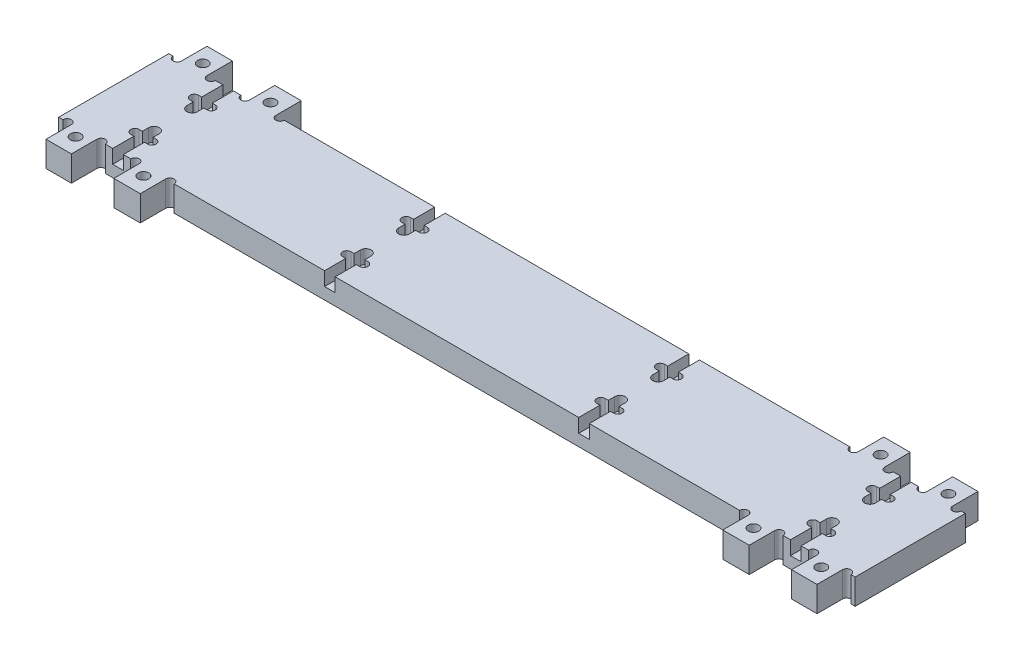
from build123d import *

# Parameters (mm, degrees)
SKETCH1_W                         = 376
SKETCH1_H                         = 52
BOSS_EXTRUDE1_DEPTH               = 12
SKETCH6_W                         = 12.5
SKETCH6_H                         = 12
SKETCH6_W_2                       = 12
BOSS_EXTRUDE2_DEPTH               = 12
F_5_0_5_DIAMETER_HOLE1_AT_2_COUNT = 2
F_5_0_5_DIAMETER_HOLE1_AT_2_PITCH = 32
MIRROR4_COPY_2_SKETCH_W           = 12.5
MIRROR4_COPY_2_SKETCH_H           = 12
MIRROR4_COPY_2_SKETCH_W_2         = 12
MIRROR4_COPY_2_DEPTH              = 12
CUT_EXTRUDE2_DEPTH                = 8
CUT_EXTRUDE5_DEPTH                = 6.5
CUT_EXTRUDE1_REACH                = 194.177
LPATTERN1_COUNT                   = 2
LPATTERN1_PITCH                   = 100
MIRROR1_COPY_1_DEPTH              = 8
MIRROR1_COPY_2_DEPTH              = 6.5
MIRROR2_COPY_1_DEPTH              = 8
MIRROR2_COPY_2_DEPTH              = 6.5
MIRROR2_COPY_3_DEPTH              = 8
MIRROR2_COPY_4_DEPTH              = 6.5
MIRROR2_COPY_5_REACH              = 194.177
MIRROR2_COPY_6_DEPTH              = 8
MIRROR2_COPY_7_DEPTH              = 6.5


with BuildPart() as part:
    # Sketch1 → Boss-Extrude1 (new body)
    with BuildSketch(Plane(origin=(0, 0, 0), x_dir=(1, 0, 0), z_dir=(0, 1, 0))):
        Rectangle(SKETCH1_W, SKETCH1_H)
    extrude(amount=BOSS_EXTRUDE1_DEPTH)

    # Sketch6 → Boss-Extrude2 (add)
    with BuildSketch(Plane(origin=(0, 12, 0), x_dir=(1, 0, 0), z_dir=(0, 1, 0))):
        with Locations((143.75, -32)):
            Rectangle(SKETCH6_W, SKETCH6_H)
        with Locations((176, -32)):
            Rectangle(SKETCH6_W_2, SKETCH6_H)
    boss_extrude2 = extrude(amount=-BOSS_EXTRUDE2_DEPTH)

    # Sketch12 → Ø5.0 (5) Diameter Hole1 (revolve, cut)
    with BuildSketch(Plane(origin=(176, 12, 30), x_dir=(0, 0, 1), z_dir=(1, 0, 0))):
        Polygon((0, 0), (0, 13.502151548), (2.5, 12), (2.5, 0), align=None)
    f_5_0_5_diameter_hole1 = revolve(axis=Axis((176, 18.35, 30), (0, -1, 0)), mode=Mode.SUBTRACT)

    # Ø5.0 (5) Diameter Hole1 at 2: Ø5.0 (5) Diameter Hole1 ×2
    with Locations(*[(-i * F_5_0_5_DIAMETER_HOLE1_AT_2_PITCH, 0, 0) for i in range(1, F_5_0_5_DIAMETER_HOLE1_AT_2_COUNT)]):
        add(f_5_0_5_diameter_hole1, mode=Mode.SUBTRACT)

    # Mirror3: Boss-Extrude2, Ø5.0 (5) Diameter Hole1 across plane
    add(boss_extrude2.mirror(Plane.XY))
    add(f_5_0_5_diameter_hole1.mirror(Plane.XY), mode=Mode.SUBTRACT)

    # Mirror3 copy 1 sketch → Mirror3 copy 1 (revolve, cut)
    with BuildSketch(Plane(origin=(144, 12, -30), x_dir=(0, 0, -1), z_dir=(1, 0, 0))):
        Polygon((0, 0), (0, -13.502151548), (2.5, -12), (2.5, 0), align=None)
    revolve(axis=Axis((144, 18.35, -30), (0, 1, 0)), mode=Mode.SUBTRACT)

    # Mirror4: Boss-Extrude2, Ø5.0 (5) Diameter Hole1 across plane
    add(boss_extrude2.mirror(Plane(origin=(0, 0, 0), x_dir=(0, 0, 1), z_dir=(1, 0, 0))))
    add(f_5_0_5_diameter_hole1.mirror(Plane(origin=(0, 0, 0), x_dir=(0, 0, 1), z_dir=(1, 0, 0))), mode=Mode.SUBTRACT)

    # Mirror4 copy 1 sketch → Mirror4 copy 1 (revolve, cut)
    with BuildSketch(Plane(origin=(-144, 12, 30), x_dir=(0, 0, 1), z_dir=(-1, 0, 0))):
        Polygon((0, 0), (0, -13.502151548), (2.5, -12), (2.5, 0), align=None)
    revolve(axis=Axis((-144, 18.35, 30), (0, 1, 0)), mode=Mode.SUBTRACT)

    # Mirror4 copy 2 sketch → Mirror4 copy 2 (add)
    with BuildSketch(Plane(origin=(0, 12, 0), x_dir=(-1, 0, 0), z_dir=(0, 1, 0))):
        with Locations((143.75, -32)):
            Rectangle(MIRROR4_COPY_2_SKETCH_W, MIRROR4_COPY_2_SKETCH_H)
        with Locations((176, -32)):
            Rectangle(MIRROR4_COPY_2_SKETCH_W_2, MIRROR4_COPY_2_SKETCH_H)
    extrude(amount=-MIRROR4_COPY_2_DEPTH)

    # Mirror4 copy 3 sketch → Mirror4 copy 3 (revolve, cut)
    with BuildSketch(Plane(origin=(-176, 12, -30), x_dir=(0, 0, -1), z_dir=(-1, 0, 0))):
        Polygon((0, 0), (0, 13.502151548), (2.5, 12), (2.5, 0), align=None)
    revolve(axis=Axis((-176, 18.35, -30), (0, -1, 0)), mode=Mode.SUBTRACT)

    # Mirror4 copy 4 sketch → Mirror4 copy 4 (revolve, cut)
    with BuildSketch(Plane(origin=(-144, 12, -30), x_dir=(0, 0, -1), z_dir=(-1, 0, 0))):
        Polygon((0, 0), (0, 13.502151548), (2.5, 12), (2.5, 0), align=None)
    revolve(axis=Axis((-144, 18.35, -30), (0, -1, 0)), mode=Mode.SUBTRACT)

    # Sketch8 → Cut-Extrude2 (cut)
    with BuildSketch(Plane(origin=(0, 12, 0), x_dir=(1, 0, 0), z_dir=(0, 1, 0))):
        with BuildLine():
            Line((-164, -12), (-156, -12))
            ThreePointArc((-156, -12), (-154, -14), (-156, -16))
            Line((-156, -16), (-164, -16))
            ThreePointArc((-164, -16), (-166, -14), (-164, -12))
        make_face()
    cut_extrude2 = extrude(amount=-CUT_EXTRUDE2_DEPTH, mode=Mode.SUBTRACT)

    # Sketch11 → Cut-Extrude5 (cut)
    with BuildSketch(Plane(origin=(0, 12, 0), x_dir=(1, 0, 0), z_dir=(0, 1, 0))):
        with BuildLine():
            Line((-157.5, -9), (-157.5, -34.810021273))
            ThreePointArc((-157.5, -34.810021273), (-160, -37.310021273), (-162.5, -34.810021273))
            Line((-162.5, -34.810021273), (-162.5, -9))
            ThreePointArc((-162.5, -9), (-160, -6.5), (-157.5, -9))
        make_face()
    cut_extrude5 = extrude(amount=-CUT_EXTRUDE5_DEPTH, mode=Mode.SUBTRACT)

    # Sketch7 → Cut-Extrude1 (cut, up to next)
    with BuildSketch(Plane(origin=(0, 12, 0), x_dir=(1, 0, 0), z_dir=(0, 1, 0)), mode=Mode.PRIVATE) as cut_extrude1_sk1:
        with BuildLine():
            Line((133.5, -26), (137.5, -26))
            ThreePointArc((137.5, -26), (135.5, -24), (133.5, -26))
        make_face()
    cut_extrude1_tool1 = extrude(cut_extrude1_sk1.sketch, amount=-CUT_EXTRUDE1_REACH, mode=Mode.PRIVATE) & part.part
    # Sketch7 → Cut-Extrude1 (cut, up to next)
    with BuildSketch(Plane(origin=(0, 12, 0), x_dir=(1, 0, 0), z_dir=(0, 1, 0)), mode=Mode.PRIVATE) as cut_extrude1_sk2:
        with BuildLine():
            Line((150, -26), (154, -26))
            ThreePointArc((154, -26), (152, -24), (150, -26))
        make_face()
    cut_extrude1_tool2 = extrude(cut_extrude1_sk2.sketch, amount=-CUT_EXTRUDE1_REACH, mode=Mode.PRIVATE) & part.part
    # Sketch7 → Cut-Extrude1 (cut, up to next)
    with BuildSketch(Plane(origin=(0, 12, 0), x_dir=(1, 0, 0), z_dir=(0, 1, 0)), mode=Mode.PRIVATE) as cut_extrude1_sk3:
        with BuildLine():
            Line((166, -26), (170, -26))
            ThreePointArc((170, -26), (168, -24), (166, -26))
        make_face()
    cut_extrude1_tool3 = extrude(cut_extrude1_sk3.sketch, amount=-CUT_EXTRUDE1_REACH, mode=Mode.PRIVATE) & part.part
    # Sketch7 → Cut-Extrude1 (cut, up to next)
    with BuildSketch(Plane(origin=(0, 12, 0), x_dir=(1, 0, 0), z_dir=(0, 1, 0)), mode=Mode.PRIVATE) as cut_extrude1_sk4:
        with BuildLine():
            Line((182, -26), (186, -26))
            ThreePointArc((186, -26), (184, -24), (182, -26))
        make_face()
    cut_extrude1_tool4 = extrude(cut_extrude1_sk4.sketch, amount=-CUT_EXTRUDE1_REACH, mode=Mode.PRIVATE) & part.part
    cut_extrude1_1 = cut_extrude1_tool1.solids().sort_by_distance((135.5, 12, 25.151174))[0]
    add(cut_extrude1_1, mode=Mode.SUBTRACT)
    cut_extrude1_2 = cut_extrude1_tool2.solids().sort_by_distance((152, 12, 25.151174))[0]
    add(cut_extrude1_2, mode=Mode.SUBTRACT)
    cut_extrude1_3 = cut_extrude1_tool3.solids().sort_by_distance((168, 12, 25.151174))[0]
    add(cut_extrude1_3, mode=Mode.SUBTRACT)
    cut_extrude1_4 = cut_extrude1_tool4.solids().sort_by_distance((184, 12, 25.151174))[0]
    add(cut_extrude1_4, mode=Mode.SUBTRACT)
    cut_extrude1 = cut_extrude1_1 + cut_extrude1_2 + cut_extrude1_3 + cut_extrude1_4  # Cut-Extrude1 as one shape, for the pattern or mirror that repeats it

    # LPattern1: Cut-Extrude2, Cut-Extrude5 ×2
    with Locations(*[(i * LPATTERN1_PITCH, 0, 0) for i in range(1, LPATTERN1_COUNT)]):
        add(cut_extrude2, mode=Mode.SUBTRACT)
        add(cut_extrude5, mode=Mode.SUBTRACT)

    # Mirror1: Cut-Extrude2, Cut-Extrude5, Cut-Extrude1 across plane
    add(cut_extrude2.mirror(Plane(origin=(0, 0, 0), x_dir=(0, 0, 1), z_dir=(1, 0, 0))), mode=Mode.SUBTRACT)
    add(cut_extrude5.mirror(Plane(origin=(0, 0, 0), x_dir=(0, 0, 1), z_dir=(1, 0, 0))), mode=Mode.SUBTRACT)
    add(cut_extrude1.mirror(Plane(origin=(0, 0, 0), x_dir=(0, 0, 1), z_dir=(1, 0, 0))), mode=Mode.SUBTRACT)

    # Mirror1 copy 1 sketch → Mirror1 copy 1 (cut)
    with BuildSketch(Plane(origin=(-100, 12, 0), x_dir=(-1, 0, 0), z_dir=(0, 1, 0))):
        with BuildLine():
            Line((-164, 12), (-156, 12))
            ThreePointArc((-156, 12), (-154, 14), (-156, 16))
            Line((-156, 16), (-164, 16))
            ThreePointArc((-164, 16), (-166, 14), (-164, 12))
        make_face()
    extrude(amount=-MIRROR1_COPY_1_DEPTH, mode=Mode.SUBTRACT)

    # Mirror1 copy 2 sketch → Mirror1 copy 2 (cut)
    with BuildSketch(Plane(origin=(-100, 12, 0), x_dir=(-1, 0, 0), z_dir=(0, 1, 0))):
        with BuildLine():
            Line((-157.5, 9), (-157.5, 34.810021273))
            ThreePointArc((-157.5, 34.810021273), (-160, 37.310021273), (-162.5, 34.810021273))
            Line((-162.5, 34.810021273), (-162.5, 9))
            ThreePointArc((-162.5, 9), (-160, 6.5), (-157.5, 9))
        make_face()
    extrude(amount=-MIRROR1_COPY_2_DEPTH, mode=Mode.SUBTRACT)

    # Mirror2: Cut-Extrude2, Cut-Extrude5, Cut-Extrude1 across plane
    add(cut_extrude2.mirror(Plane.XY), mode=Mode.SUBTRACT)
    add(cut_extrude5.mirror(Plane.XY), mode=Mode.SUBTRACT)
    add(cut_extrude1.mirror(Plane.XY), mode=Mode.SUBTRACT)

    # Mirror2 copy 1 sketch → Mirror2 copy 1 (cut)
    with BuildSketch(Plane(origin=(100, 12, 0), x_dir=(1, 0, 0), z_dir=(0, 1, 0))):
        with BuildLine():
            Line((-164, 12), (-156, 12))
            ThreePointArc((-156, 12), (-154, 14), (-156, 16))
            Line((-156, 16), (-164, 16))
            ThreePointArc((-164, 16), (-166, 14), (-164, 12))
        make_face()
    extrude(amount=-MIRROR2_COPY_1_DEPTH, mode=Mode.SUBTRACT)

    # Mirror2 copy 2 sketch → Mirror2 copy 2 (cut)
    with BuildSketch(Plane(origin=(100, 12, 0), x_dir=(1, 0, 0), z_dir=(0, 1, 0))):
        with BuildLine():
            Line((-157.5, 9), (-157.5, 34.810021273))
            ThreePointArc((-157.5, 34.810021273), (-160, 37.310021273), (-162.5, 34.810021273))
            Line((-162.5, 34.810021273), (-162.5, 9))
            ThreePointArc((-162.5, 9), (-160, 6.5), (-157.5, 9))
        make_face()
    extrude(amount=-MIRROR2_COPY_2_DEPTH, mode=Mode.SUBTRACT)

    # Mirror2 copy 3 sketch → Mirror2 copy 3 (cut)
    with BuildSketch(Plane(origin=(0, 12, 0), x_dir=(-1, 0, 0), z_dir=(0, 1, 0))):
        with BuildLine():
            Line((-164, -12), (-156, -12))
            ThreePointArc((-156, -12), (-154, -14), (-156, -16))
            Line((-156, -16), (-164, -16))
            ThreePointArc((-164, -16), (-166, -14), (-164, -12))
        make_face()
    extrude(amount=-MIRROR2_COPY_3_DEPTH, mode=Mode.SUBTRACT)

    # Mirror2 copy 4 sketch → Mirror2 copy 4 (cut)
    with BuildSketch(Plane(origin=(0, 12, 0), x_dir=(-1, 0, 0), z_dir=(0, 1, 0))):
        with BuildLine():
            Line((-157.5, -9), (-157.5, -34.810021273))
            ThreePointArc((-157.5, -34.810021273), (-160, -37.310021273), (-162.5, -34.810021273))
            Line((-162.5, -34.810021273), (-162.5, -9))
            ThreePointArc((-162.5, -9), (-160, -6.5), (-157.5, -9))
        make_face()
    extrude(amount=-MIRROR2_COPY_4_DEPTH, mode=Mode.SUBTRACT)

    # Mirror2 copy 5 sketch → Mirror2 copy 5 (cut, up to next)
    with BuildSketch(Plane(origin=(0, 12, 0), x_dir=(-1, 0, 0), z_dir=(0, 1, 0)), mode=Mode.PRIVATE) as mirror2_copy_5_sk1:
        with BuildLine():
            Line((133.5, -26), (137.5, -26))
            ThreePointArc((137.5, -26), (135.5, -24), (133.5, -26))
        make_face()
    mirror2_copy_5_tool1 = extrude(mirror2_copy_5_sk1.sketch, amount=-MIRROR2_COPY_5_REACH, mode=Mode.PRIVATE) & part.part
    # Mirror2 copy 5 sketch → Mirror2 copy 5 (cut, up to next)
    with BuildSketch(Plane(origin=(0, 12, 0), x_dir=(-1, 0, 0), z_dir=(0, 1, 0)), mode=Mode.PRIVATE) as mirror2_copy_5_sk2:
        with BuildLine():
            Line((150, -26), (154, -26))
            ThreePointArc((154, -26), (152, -24), (150, -26))
        make_face()
    mirror2_copy_5_tool2 = extrude(mirror2_copy_5_sk2.sketch, amount=-MIRROR2_COPY_5_REACH, mode=Mode.PRIVATE) & part.part
    # Mirror2 copy 5 sketch → Mirror2 copy 5 (cut, up to next)
    with BuildSketch(Plane(origin=(0, 12, 0), x_dir=(-1, 0, 0), z_dir=(0, 1, 0)), mode=Mode.PRIVATE) as mirror2_copy_5_sk3:
        with BuildLine():
            Line((166, -26), (170, -26))
            ThreePointArc((170, -26), (168, -24), (166, -26))
        make_face()
    mirror2_copy_5_tool3 = extrude(mirror2_copy_5_sk3.sketch, amount=-MIRROR2_COPY_5_REACH, mode=Mode.PRIVATE) & part.part
    # Mirror2 copy 5 sketch → Mirror2 copy 5 (cut, up to next)
    with BuildSketch(Plane(origin=(0, 12, 0), x_dir=(-1, 0, 0), z_dir=(0, 1, 0)), mode=Mode.PRIVATE) as mirror2_copy_5_sk4:
        with BuildLine():
            Line((182, -26), (186, -26))
            ThreePointArc((186, -26), (184, -24), (182, -26))
        make_face()
    mirror2_copy_5_tool4 = extrude(mirror2_copy_5_sk4.sketch, amount=-MIRROR2_COPY_5_REACH, mode=Mode.PRIVATE) & part.part
    add(mirror2_copy_5_tool1.solids().sort_by_distance((-135.5, 12, -25.151174))[0], mode=Mode.SUBTRACT)
    add(mirror2_copy_5_tool2.solids().sort_by_distance((-152, 12, -25.151174))[0], mode=Mode.SUBTRACT)
    add(mirror2_copy_5_tool3.solids().sort_by_distance((-168, 12, -25.151174))[0], mode=Mode.SUBTRACT)
    add(mirror2_copy_5_tool4.solids().sort_by_distance((-184, 12, -25.151174))[0], mode=Mode.SUBTRACT)

    # Mirror2 copy 6 sketch → Mirror2 copy 6 (cut)
    with BuildSketch(Plane(origin=(-100, 12, 0), x_dir=(-1, 0, 0), z_dir=(0, 1, 0))):
        with BuildLine():
            Line((-164, -12), (-156, -12))
            ThreePointArc((-156, -12), (-154, -14), (-156, -16))
            Line((-156, -16), (-164, -16))
            ThreePointArc((-164, -16), (-166, -14), (-164, -12))
        make_face()
    extrude(amount=-MIRROR2_COPY_6_DEPTH, mode=Mode.SUBTRACT)

    # Mirror2 copy 7 sketch → Mirror2 copy 7 (cut)
    with BuildSketch(Plane(origin=(-100, 12, 0), x_dir=(-1, 0, 0), z_dir=(0, 1, 0))):
        with BuildLine():
            Line((-157.5, -9), (-157.5, -34.810021273))
            ThreePointArc((-157.5, -34.810021273), (-160, -37.310021273), (-162.5, -34.810021273))
            Line((-162.5, -34.810021273), (-162.5, -9))
            ThreePointArc((-162.5, -9), (-160, -6.5), (-157.5, -9))
        make_face()
    extrude(amount=-MIRROR2_COPY_7_DEPTH, mode=Mode.SUBTRACT)


solid = part.part
